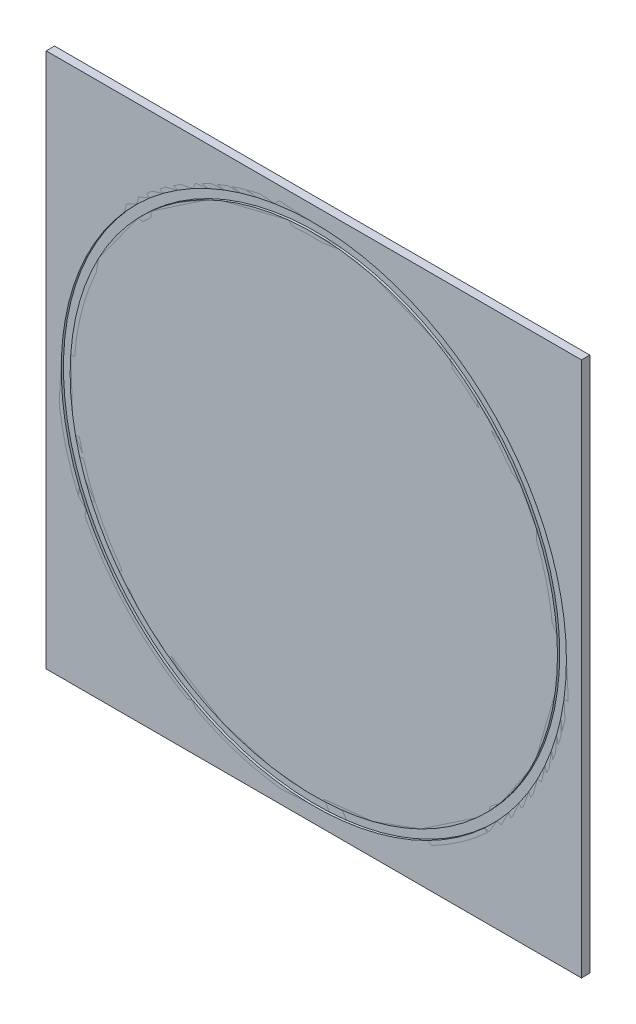
from build123d import *

# Parameters (mm, degrees)
SKETCH2_R           = 584.2
SKETCH2_R_2         = 546.1
BOSS_EXTRUDE1_DEPTH = 19.05
SKETCH3_W           = 1219.2
SKETCH3_H           = 1219.2
STOCK_DEPTH         = 19.05
SKETCH5_R           = 575.31
SKETCH5_R_2         = 554.99
CUT_EXTRUDE1_DEPTH  = 5.08


with BuildPart() as part:
    # Sketch2 → Boss-Extrude1 (new body)
    with BuildSketch(Plane.XY):
        with Locations(Location((0, 0, 0), (0, 0, 180))):
            Circle(SKETCH2_R)
        with Locations(Location((0, 0, 0), (0, 0, 180))):
            Circle(SKETCH2_R_2, mode=Mode.SUBTRACT)
    extrude(amount=BOSS_EXTRUDE1_DEPTH)


with BuildPart() as body_2:
    # Sketch3 → Stock (new body)
    with BuildSketch(Plane.XY.offset(19.05)):
        Rectangle(SKETCH3_W, SKETCH3_H)
    extrude(amount=-STOCK_DEPTH)


with BuildPart() as cut_extrude1_tool:
    # Sketch5 → Cut-Extrude1 (new body)
    with BuildSketch(Plane.XY.offset(19.05)):
        Circle(SKETCH5_R)
        Circle(SKETCH5_R_2, mode=Mode.SUBTRACT)
    extrude(amount=-CUT_EXTRUDE1_DEPTH)


with BuildPart() as part_1:
    add(part.part)

    # Cut-Extrude1: cut by cut_extrude1_tool
    add(cut_extrude1_tool.part, mode=Mode.SUBTRACT)


with BuildPart() as body_2_1:
    add(body_2.part)

    # Cut-Extrude1: cut by cut_extrude1_tool
    add(cut_extrude1_tool.part, mode=Mode.SUBTRACT)


solid = Compound([part_1.part, body_2_1.part])
